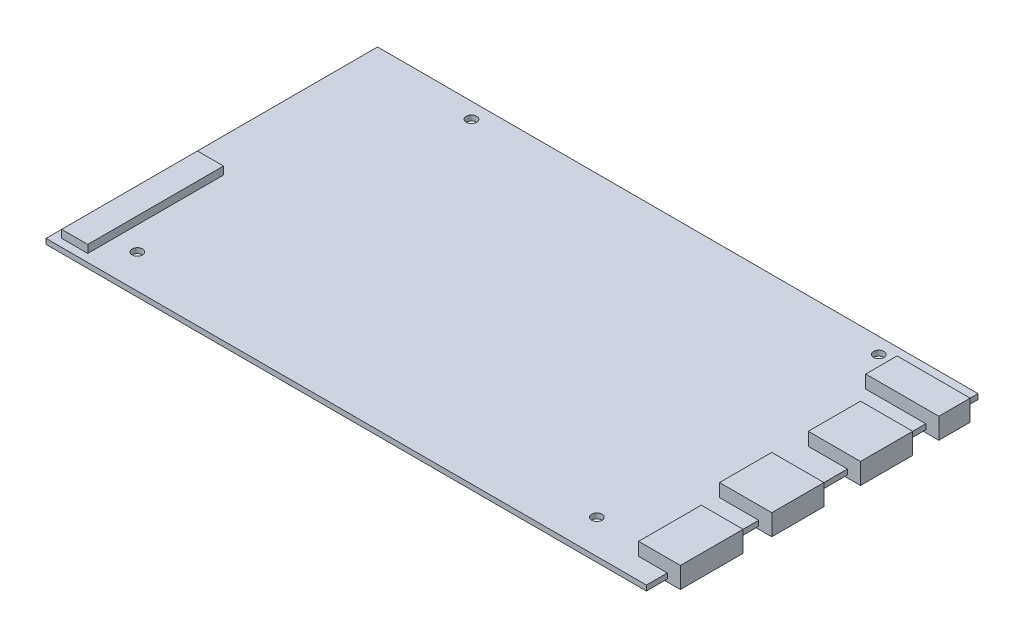
from build123d import *

# Parameters (mm, degrees)
SKETCH1_W               = 115
SKETCH1_H               = 63.5
SKETCH1_R               = 1
PCB_DEPTH               = 1
CONNECTORS_DEPTH        = 3.5
CONNECTORS_DEPTH_BACK   = 0.5
SKETCH2_W               = 8
SKETCH2_H               = 12
SKETCH2_W_2             = 10
SKETCH2_H_2             = 10
SKETCH2_W_3             = 14
SKETCH2_H_3             = 6
SKETCH3_W               = 5
SKETCH3_H               = 26
DISPLAY_CONNECTOR_DEPTH = 1.5


with BuildPart() as part:
    # Sketch1 → PCB (new body)
    with BuildSketch(Plane(origin=(0, 0, 0), x_dir=(1, 0, 0), z_dir=(0, 1, 0))):
        Rectangle(SKETCH1_W, SKETCH1_H)
        with Locations(Location((-46.5, -25.25, 0), (0, 0, 270))):
            Circle(SKETCH1_R, mode=Mode.SUBTRACT)
        with Locations(Location((-36.5, 28.75, 0), (0, 0, 270))):
            Circle(SKETCH1_R, mode=Mode.SUBTRACT)
        with Locations(Location((41.5, 28.75, 0), (0, 0, 270))):
            Circle(SKETCH1_R, mode=Mode.SUBTRACT)
        with Locations(Location((41.5, -25.25, 0), (0, 0, 270))):
            Circle(SKETCH1_R, mode=Mode.SUBTRACT)
    extrude(amount=PCB_DEPTH)

    # Sketch2 → CONNECTORS (add, two sides: drawn at the far end of the back side and taken through both)
    with BuildSketch(Plane(origin=(0, 0, 0), x_dir=(1, 0, 0), z_dir=(0, 1, 0)).offset(-CONNECTORS_DEPTH_BACK)):
        with Locations((56, -21.75)):
            Rectangle(SKETCH2_W, SKETCH2_H)
        with Locations((55, -5.25)):
            Rectangle(SKETCH2_W_2, SKETCH2_H_2)
        with Locations((55, 11.75)):
            Rectangle(SKETCH2_W_2, SKETCH2_H_2)
        with Locations((53, 24.75)):
            Rectangle(SKETCH2_W_3, SKETCH2_H_3)
    extrude(amount=CONNECTORS_DEPTH + CONNECTORS_DEPTH_BACK)

    # Sketch3 → DISPLAY CONNECTOR (add)
    with BuildSketch(Plane(origin=(0, 1, 0), x_dir=(1, 0, 0), z_dir=(0, 1, 0))):
        with Locations((-53.5, -17.25)):
            Rectangle(SKETCH3_W, SKETCH3_H)
    extrude(amount=DISPLAY_CONNECTOR_DEPTH)


solid = part.part
